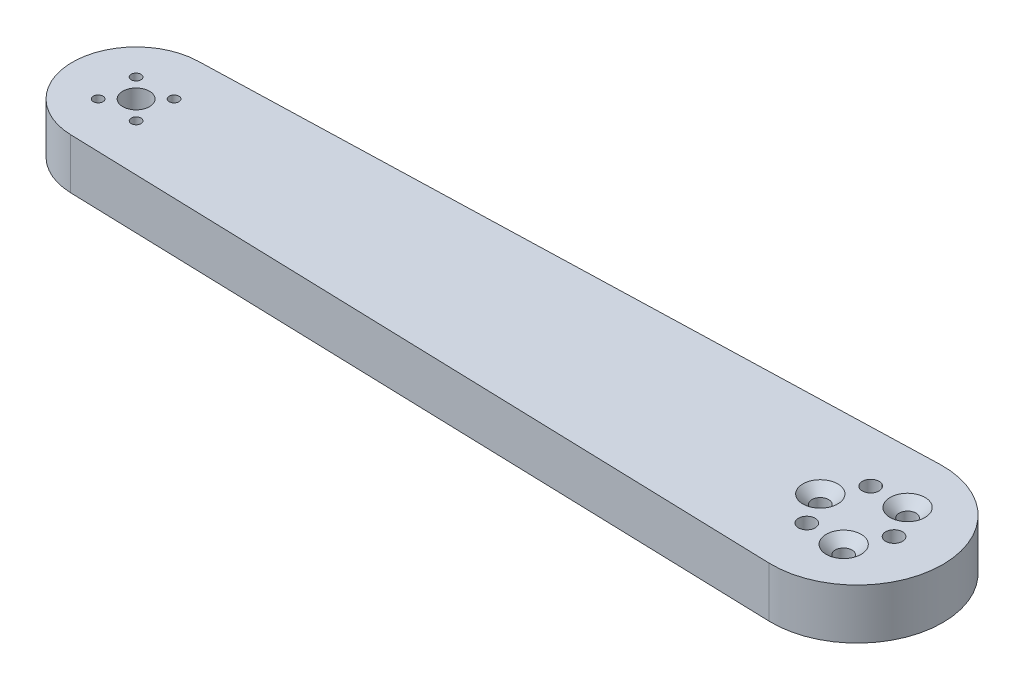
from build123d import *

# Parameters (mm, degrees)
SKETCH_1_R      = 4
SKETCH_1_R_2    = 2.5
SKETCH_1_R_3    = 1.45
EXTRUDE_1_DEPTH = 15
CHAMFER_1_SIZE  = 1.8
CHAMFER_2_SIZE  = 2.7


with BuildPart() as part:
    # 草图1 → 凸台-拉伸1 (new body)
    with BuildSketch(Plane(origin=(0, 0, 0), x_dir=(1, 0, 0), z_dir=(0, 1, 0))):
        with BuildLine():
            Line((-0.574418605, 18.991314943), (214.229069767, 25.488343739))
            ThreePointArc((214.229069767, 25.488343739), (240.5, 0), (214.229069767, -25.488343739))
            Line((214.229069767, -25.488343739), (-0.574418605, -18.991314943))
            ThreePointArc((-0.574418605, -18.991314943), (-19, 0), (-0.574418605, 18.991314943))
        make_face()
        with Locations(Location((0, 0, 0), (0, 0, 270))):
            Circle(SKETCH_1_R, mode=Mode.SUBTRACT)
        with Locations(Location((209.5, 9.526279442, 0), (0, 0, 270))):
            Circle(SKETCH_1_R_2, mode=Mode.SUBTRACT)
        with Locations(Location((220.5, 9.526279442, 0), (0, 0, 270))):
            Circle(SKETCH_1_R_2, mode=Mode.SUBTRACT)
        with Locations(Location((226, 0, 0), (0, 0, 270))):
            Circle(SKETCH_1_R_2, mode=Mode.SUBTRACT)
        with Locations(Location((220.5, -9.526279442, 0), (0, 0, 270))):
            Circle(SKETCH_1_R_2, mode=Mode.SUBTRACT)
        with Locations(Location((209.5, -9.526279442, 0), (0, 0, 270))):
            Circle(SKETCH_1_R_2, mode=Mode.SUBTRACT)
        with Locations(Location((204, 0, 0), (0, 0, 270))):
            Circle(SKETCH_1_R_2, mode=Mode.SUBTRACT)
        with Locations(Location((-5.656854249, 5.656854249, 0), (0, 0, 270))):
            Circle(SKETCH_1_R_3, mode=Mode.SUBTRACT)
        with Locations(Location((5.656854249, 5.656854249, 0), (0, 0, 270))):
            Circle(SKETCH_1_R_3, mode=Mode.SUBTRACT)
        with Locations(Location((5.656854249, -5.656854249, 0), (0, 0, 270))):
            Circle(SKETCH_1_R_3, mode=Mode.SUBTRACT)
        with Locations(Location((-5.656854249, -5.656854249, 0), (0, 0, 270))):
            Circle(SKETCH_1_R_3, mode=Mode.SUBTRACT)
    extrude(amount=EXTRUDE_1_DEPTH)

    # 倒角1
    chamfer_1_edges = [part.edges().sort_by_distance(p)[0] for p in [
        (5.656854249, 0, -7.106854249),
        (-5.656854249, 0, -7.106854249),
        (5.656854249, 0, 4.206854249),
        (-5.656854249, 0, 4.206854249),
    ]]
    chamfer(chamfer_1_edges, length=CHAMFER_1_SIZE)

    # 倒角2
    chamfer_2_edges = [part.edges().sort_by_distance(p)[0] for p in [
        (220.5, 15, -12.026279442),
        (220.5, 15, 7.026279442),
        (204, 15, -2.5),
    ]]
    chamfer(chamfer_2_edges, length=CHAMFER_2_SIZE)


solid = part.part
